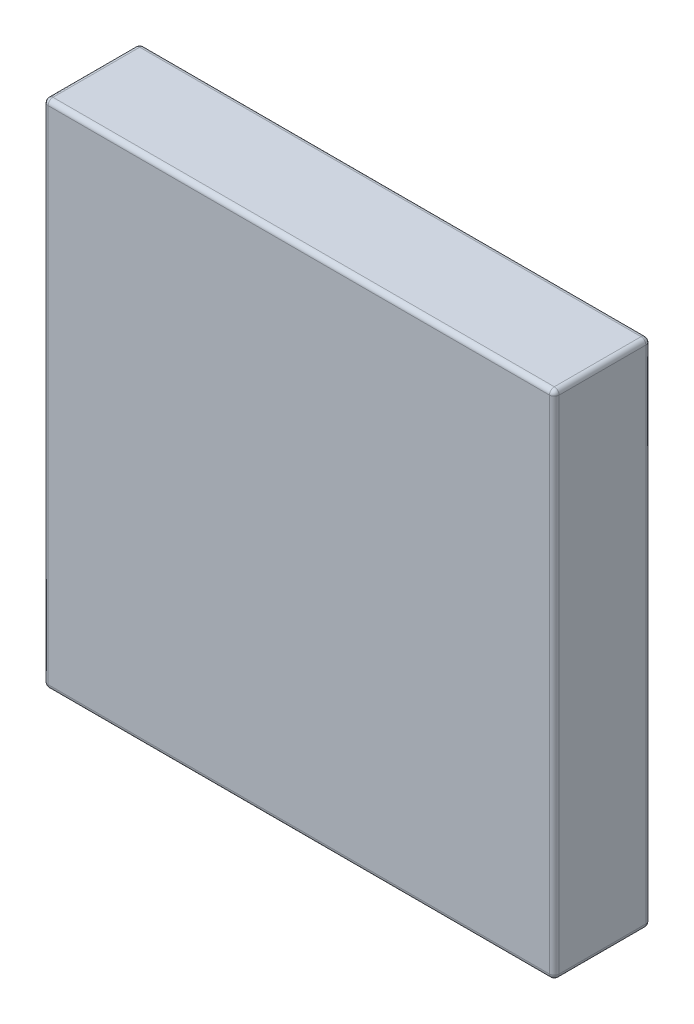
from build123d import *

# Parameters (mm, degrees)
SKETCH_1_W      = 53.033008589
SKETCH_1_H      = 53.033008589
EXTRUDE_1_DEPTH = 10
FILLET_1_R      = 0.5


with BuildPart() as part:
    # 草图1 → 凸台-拉伸1 (new body)
    with BuildSketch(Plane.XY):
        with Locations((26.516504295, 26.516504295)):
            Rectangle(SKETCH_1_W, SKETCH_1_H)
    extrude(amount=EXTRUDE_1_DEPTH)

    # 圆角1
    fillet_1_edges = [part.edges().sort_by_distance(p)[0] for p in [
        (26.516504294, 53.033008589, 10),
        (0, 26.516504294, 10),
        (26.516504294, 0, 10),
        (0, 26.516504294, 0),
        (26.516504294, 53.033008589, 0),
        (53.033008589, 26.516504294, 0),
        (26.516504294, 0, 0),
        (53.033008589, 26.516504294, 10),
        (0, 0, 5),
        (0, 53.033008589, 5),
        (53.033008589, 53.033008589, 5),
        (53.033008589, 0, 5),
    ]]
    fillet(fillet_1_edges, radius=FILLET_1_R)


solid = part.part
